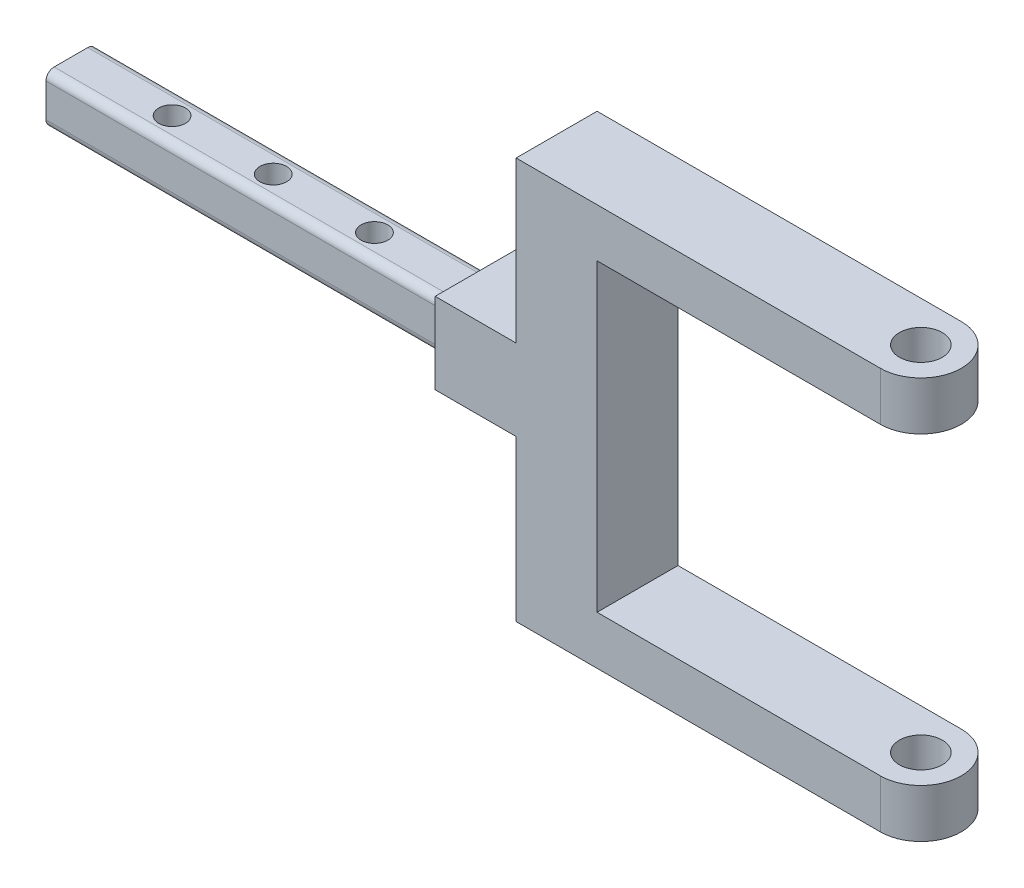
from build123d import *

# Parameters (mm, degrees)
EXTRUDE_1_DEPTH     = 10
SKETCH_2_W          = 10
SKETCH_2_H          = 10
SKETCH_2_W_2        = 6.15
SKETCH_2_H_2        = 6.15
EXTRUDE_2_DEPTH     = 10
EXTRUDE_START       = 10
SKETCH_2_3_W        = 6.15
SKETCH_2_3_H        = 6.15
EXTRUDE_3_DEPTH     = 50
CUT_EXTRUDE_1_DEPTH = 87.372217755
SKETCH_4_R          = 1.65
CUT_EXTRUDE_2_DEPTH = 77.00668145
FILLET_1_R          = 1


with BuildPart() as part:
    # 草图1 → 凸台-拉伸1 (new body)
    with BuildSketch(Plane.XY):
        Polygon((0, 18.8), (0, -18.8), (40, -18.8), (40, -24.8), (-10, -24.8), (-10, 24.8), (40, 24.8), (40, 18.8), align=None)
    extrude(amount=EXTRUDE_1_DEPTH)

    # 草图2 → 凸台-拉伸2 (add)
    # profile 1 of 2: a face of its own
    with BuildSketch(Plane.ZY.offset(10)):
        with Locations((5, 0)):
            Rectangle(SKETCH_2_W, SKETCH_2_H)
        with Locations((5, 0)):
            Rectangle(SKETCH_2_W_2, SKETCH_2_H_2, mode=Mode.SUBTRACT)
    # profile 2 of 2: a face of its own
    with BuildSketch(Plane.ZY.offset(10)):
        with Locations((5, 0)):
            Rectangle(SKETCH_2_W_2, SKETCH_2_H_2)
    extrude(amount=EXTRUDE_2_DEPTH)

    # 草图2<3> → 凸台-拉伸3 (add)
    with BuildSketch(Plane.ZY.offset(10).offset(EXTRUDE_START)):
        with Locations((5, 0)):
            Rectangle(SKETCH_2_3_W, SKETCH_2_3_H)
    extrude(amount=EXTRUDE_3_DEPTH)

    # 草图3 → 切除-拉伸1 (cut, through all)
    with BuildSketch(Plane(origin=(0, 24.8, 0), x_dir=(1, 0, 0), z_dir=(0, 1, 0))):
        with BuildLine():
            ThreePointArc((32.35, -5), (35, -7.65), (37.65, -5))
            Line((37.65, -5), (32.35, -5))
        make_face()
        with BuildLine():
            Line((32.35, -5), (37.65, -5))
            ThreePointArc((37.65, -5), (35, -2.35), (32.35, -5))
        make_face()
        with BuildLine():
            ThreePointArc((35, 0), (38.535533906, -1.464466094), (40, -5))
            Line((40, -5), (40, 0))
            Line((40, 0), (35, 0))
        make_face()
        with BuildLine():
            Line((40, -10), (40, -5))
            ThreePointArc((40, -5), (38.535533906, -8.535533906), (35, -10))
            Line((35, -10), (40, -10))
        make_face()
    extrude(amount=-CUT_EXTRUDE_1_DEPTH, mode=Mode.SUBTRACT)

    # 草图4 → 切除-拉伸2 (cut, through all)
    with BuildSketch(Plane(origin=(0, 3.075, 0), x_dir=(1, 0, 0), z_dir=(0, 1, 0))):
        with Locations(Location((-45, -5, 0), (0, 0, 180))):
            Circle(SKETCH_4_R)
        with Locations(Location((-32.5, -5, 0), (0, 0, 180))):
            Circle(SKETCH_4_R)
        with Locations(Location((-57.5, -5, 0), (0, 0, 180))):
            Circle(SKETCH_4_R)
    extrude(amount=-CUT_EXTRUDE_2_DEPTH, mode=Mode.SUBTRACT)

    # 圆角1
    fillet_1_edges = [part.edges().sort_by_distance(p)[0] for p in [
        (-45, -3.075, 1.925),
        (-45, -3.075, 8.075),
        (-45, 3.075, 8.075),
        (-45, 3.075, 1.925),
    ]]
    fillet(fillet_1_edges, radius=FILLET_1_R)


solid = part.part
